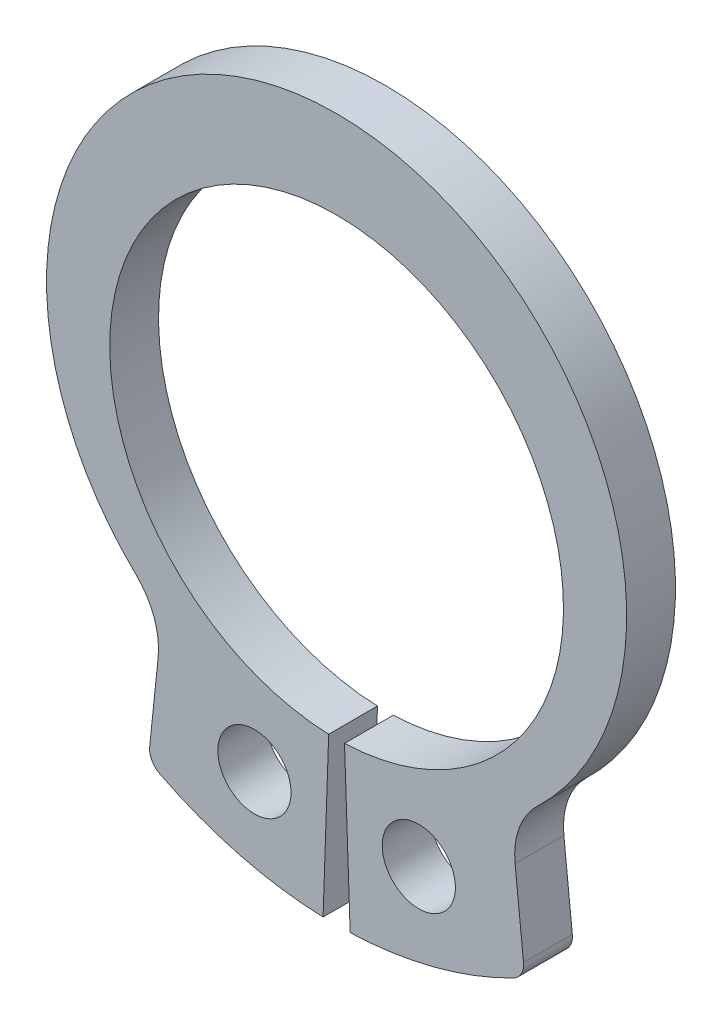
from build123d import *

# Parameters (mm, degrees)
SKETCH4_R           = 0.75
BOSS_EXTRUDE1_DEPTH = 0.5
FILLET1_R           = 1.514721005
FILLET2_R           = 0.378680251


with BuildPart() as part:
    # Sketch4 → Boss-Extrude1 (new, symmetric)
    with BuildSketch(Plane.XY):
        with BuildLine():
            Line((-3.857781527, -6.956802039), (-3.575899706, -4.244460071))
            ThreePointArc((-3.575899706, -4.244460071), (-5.638229663, 2.390185537), (0, 6.45))
            Line((0, 6.45), (0, 4.65))
            ThreePointArc((0, 4.65), (-4.649291782, 0.08115369), (-0.16228266, -4.647167346))
            Line((-0.16228266, -4.647167346), (-0.277620117, -7.95))
            ThreePointArc((-0.277620117, -7.95), (-2.126498822, -7.665349026), (-3.857781527, -6.956802039))
        make_face()
        with Locations((-1.684771165, -6.073061915)):
            Circle(SKETCH4_R, mode=Mode.SUBTRACT)
    extrude(amount=BOSS_EXTRUDE1_DEPTH, both=True)

    # Fillet1
    fillet1_edges = [part.edges().sort_by_distance(p)[0] for p in [
        (-3.575899706, -4.244460071, 0),
    ]]
    fillet(fillet1_edges, radius=FILLET1_R)

    # Fillet2
    fillet2_edges = [part.edges().sort_by_distance(p)[0] for p in [
        (-3.857781527, -6.956802039, 0),
    ]]
    fillet(fillet2_edges, radius=FILLET2_R)

    # Mirror1: part across plane


with BuildPart() as part_1:
    add(part.part)
    add(part.part.mirror(Plane(origin=(0, 6.45, 0.5), x_dir=(0, 0, 1), z_dir=(-1, 0, 0))))


solid = part_1.part
